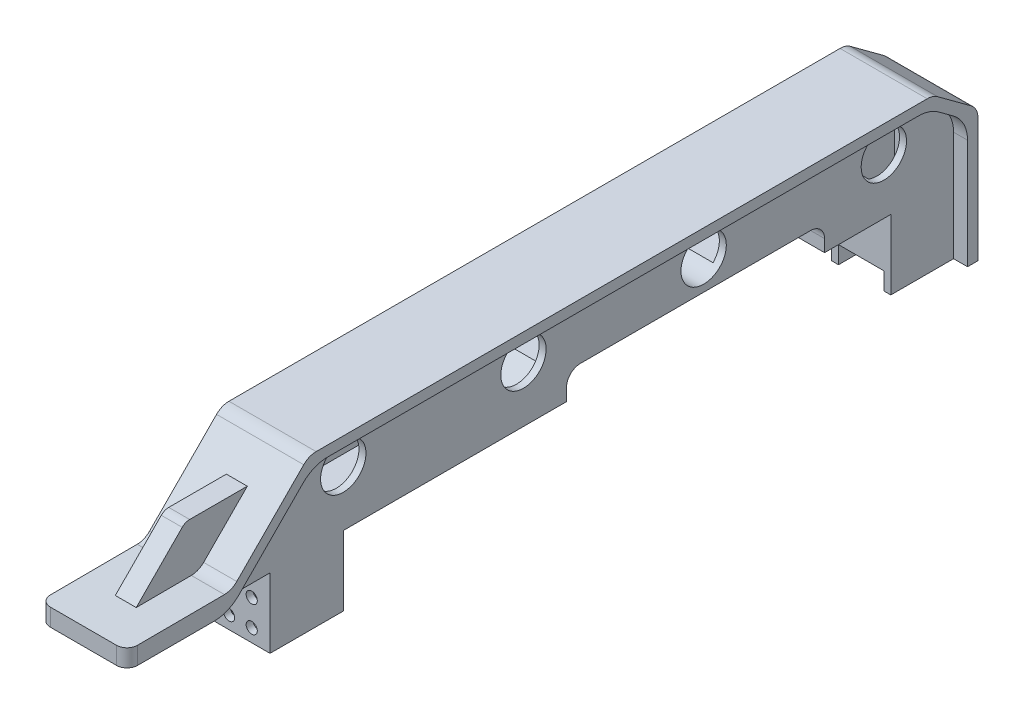
from build123d import *

# Parameters (mm, degrees)
BOSS_EXTRUDE1_DEPTH      = 25
CUT_EXTRUDE1_DEPTH       = 4
FILLET1_R                = 4
FILLET2_R                = 10
FILLET3_R                = 5
FILLET4_R                = 3
BOSS_EXTRUDE2_DEPTH      = 3
BOSS_EXTRUDE2_DEPTH_BACK = 3
FILLET5_R                = 3
SKETCH6_W                = 13
SKETCH6_H                = 14
BOSS_EXTRUDE3_DEPTH      = 20
BOSS_EXTRUDE4_DEPTH      = 20
SKETCH9_W                = 13
SKETCH9_H                = 2
BOSS_EXTRUDE5_DEPTH      = 8
SKETCH7_W                = 13
SKETCH7_H                = 2
CUT_EXTRUDE2_DEPTH       = 5
SKETCH11_R               = 1.6
CUT_EXTRUDE3_DEPTH       = 19
CUT_EXTRUDE4_START       = -2
SKETCH12_R               = 1.6
CUT_EXTRUDE4_DEPTH       = 2
CUT_EXTRUDE5_DEPTH       = 6.5
CUT_EXTRUDE5_DEPTH_BACK  = 6.5
CUT_EXTRUDE6_START       = -17
SKETCH15_R               = 6.5
CUT_EXTRUDE6_DEPTH       = 17


with BuildPart() as part:
    # Sketch1 → Boss-Extrude1 (new body)
    with BuildSketch(Plane(origin=(0, 0, 0), x_dir=(0, 0, -1), z_dir=(1, 0, 0))):
        Polygon((0, 0), (-130, 0), (-130, 5), (-100.000366453, 5.148280317), (-77.868517379, 27.5), (101.088229162, 27.5), (114, 18), (114, 0), (74, 0), (74, 7.5), (0, 7.5), align=None)
    extrude(amount=BOSS_EXTRUDE1_DEPTH)

    # Sketch4 → Cut-Extrude1 (cut)
    with BuildSketch(Plane(origin=(25, 0, 0), x_dir=(0, 0, -1), z_dir=(1, 0, 0))):
        Polygon((-100.876178749, 0), (0, 0), (111, 0), (111, 3), (111, 16.482758557), (100.103496394, 24.5), (-76.617181678, 24.5), align=None)
    cut_extrude1 = extrude(amount=-CUT_EXTRUDE1_DEPTH, mode=Mode.SUBTRACT)

    # Mirror2: Cut-Extrude1 across plane
    add(cut_extrude1.mirror(Plane(origin=(12.5, 0, 0), x_dir=(0, 0, 1), z_dir=(1, 0, 0))), mode=Mode.SUBTRACT)

    # Fillet1
    fillet1_edges = [part.edges().sort_by_distance(p)[0] for p in [
        (12.5, 7.5, -74),
        (12.5, 7.5, 0),
    ]]
    fillet(fillet1_edges, radius=FILLET1_R)

    # Fillet2
    fillet2_edges = [part.edges().sort_by_distance(p)[0] for p in [
        (23, 0, 100.876178749),
        (23, 24.5, 76.617181678),
        (23, 24.5, -100.103496394),
        (23, 16.482758557, -111),
        (2, 0, 100.876178749),
        (2, 16.482758557, -111),
        (2, 24.5, -100.103496394),
        (2, 24.5, 76.617181678),
    ]]
    fillet(fillet2_edges, radius=FILLET2_R)

    # Fillet3
    fillet3_edges = [part.edges().sort_by_distance(p)[0] for p in [
        (12.5, 5.148280317, 100.000366453),
        (12.5, 27.5, 77.868517379),
        (12.5, 27.5, -101.088229162),
        (12.5, 18, -114),
    ]]
    fillet(fillet3_edges, radius=FILLET3_R)

    # Fillet4
    fillet4_edges = [part.edges().sort_by_distance(p)[0] for p in [
        (0, 2.5, 130),
        (25, 2.5, 130),
    ]]
    fillet(fillet4_edges, radius=FILLET4_R)

    # Sketch5 → Boss-Extrude2 (add, two sides: drawn at the far end of the back side and taken through both)
    with BuildSketch(Plane(origin=(12.5, 0, 0), x_dir=(0, 0, -1), z_dir=(1, 0, 0)).offset(-BOSS_EXTRUDE2_DEPTH_BACK)):
        Polygon((-117.8659777, 5.059975288), (-103.793914836, 19.271838176), (-72.605250228, 19.271838176), (-95.8659777, 5.059975288), align=None)
    extrude(amount=BOSS_EXTRUDE2_DEPTH + BOSS_EXTRUDE2_DEPTH_BACK)

    # Fillet5
    fillet5_edges = [part.edges().sort_by_distance(p)[0] for p in [
        (12.5, 19.271838176, 103.793914836),
    ]]
    fillet(fillet5_edges, radius=FILLET5_R)

    # Sketch6 → Boss-Extrude3 (add)
    with BuildSketch(Plane.XZ):
        Polygon((0, -111), (4, -111), (4, -93), (21, -93), (21, -111), (25, -111), (25, -114), (0, -114), align=None)
        with Locations((12.5, -102)):
            Rectangle(SKETCH6_W, SKETCH6_H, mode=Mode.SUBTRACT)
    extrude(amount=BOSS_EXTRUDE3_DEPTH)

    # Sketch8 → Boss-Extrude4 (add)
    with BuildSketch(Plane.XZ):
        Polygon((21, 85), (4, 85), (4, 64), (6, 64), (6, 83), (19, 83), (19, 64), (21, 64), align=None)
    extrude(amount=BOSS_EXTRUDE4_DEPTH)

    # Sketch9 → Boss-Extrude5 (add)
    with BuildSketch(Plane.XZ):
        with Locations((12.5, 65)):
            Rectangle(SKETCH9_W, SKETCH9_H)
    extrude(amount=BOSS_EXTRUDE5_DEPTH)

    # Sketch7 → Cut-Extrude2 (cut)
    with BuildSketch(Plane.XZ.offset(20)):
        with Locations((12.5, -94)):
            Rectangle(SKETCH7_W, SKETCH7_H)
    extrude(amount=-CUT_EXTRUDE2_DEPTH, mode=Mode.SUBTRACT)

    # Sketch11 → Cut-Extrude3 (cut)
    with BuildSketch(Plane(origin=(0, 0, -114), x_dir=(-1, 0, 0), z_dir=(0, 0, -1))):
        with Locations((-15.75, -16.25)):
            Circle(SKETCH11_R)
        with Locations((-15.75, -8.75)):
            Circle(SKETCH11_R)
        with Locations((-9.25, -8.75)):
            Circle(SKETCH11_R)
        with Locations((-9.25, -16.25)):
            Circle(SKETCH11_R)
    extrude(amount=-CUT_EXTRUDE3_DEPTH, mode=Mode.SUBTRACT)

    # Sketch12 → Cut-Extrude4 (cut)
    with BuildSketch(Plane.XY.offset(85).offset(CUT_EXTRUDE4_START)):
        with Locations(Location((15.75, -16.25, 0), (0, 0, 180))):
            Circle(SKETCH12_R)
        with Locations(Location((9.25, -16.25, 0), (0, 0, 180))):
            Circle(SKETCH12_R)
        with Locations(Location((9.25, -8.75, 0), (0, 0, 180))):
            Circle(SKETCH12_R)
        with Locations(Location((15.75, -8.75, 0), (0, 0, 180))):
            Circle(SKETCH12_R)
    extrude(amount=CUT_EXTRUDE4_DEPTH, mode=Mode.SUBTRACT)

    # Sketch14 → Cut-Extrude5 (cut, two sides: drawn at the far end of the back side and taken through both)
    with BuildSketch(Plane(origin=(12.5, 0, 0), x_dir=(0, 0, -1), z_dir=(1, 0, 0)).offset(-CUT_EXTRUDE5_DEPTH_BACK)):
        Polygon((-83, 0), (-83, 13.475167258), (-72.975167258, 23.5), (95.592427597, 23.5), (109, 10.092427597), (109, 0), (95, 0), (95, 3.57939317), (87.07939317, 11.5), (-5.825100808, 11.5), (-13.325100808, 4), (-66, 4), (-66, 0), align=None)
    extrude(amount=CUT_EXTRUDE5_DEPTH + CUT_EXTRUDE5_DEPTH_BACK, mode=Mode.SUBTRACT)

    # Sketch15 → Cut-Extrude6 (cut)
    with BuildSketch(Plane.ZY.offset(-4).offset(CUT_EXTRUDE6_START)):
        with Locations((-91, 16)):
            Circle(SKETCH15_R)
        with Locations((-39.333333333, 16)):
            Circle(SKETCH15_R)
        with Locations((64, 16)):
            Circle(SKETCH15_R)
        with Locations((12.333333333, 16)):
            Circle(SKETCH15_R)
    extrude(amount=CUT_EXTRUDE6_DEPTH, mode=Mode.SUBTRACT)


solid = part.part
